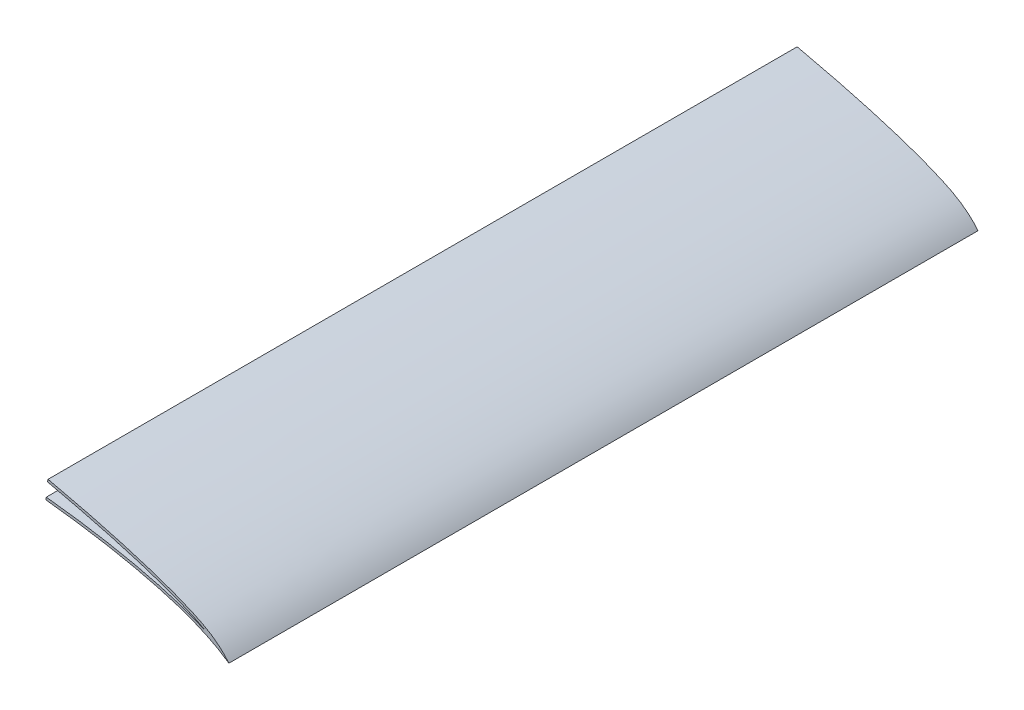
from build123d import *

# Parameters (mm, degrees)
BOSS_EXTRUDE1_DEPTH = 457.2


with BuildPart() as part:
    # Sketch1 → Boss-Extrude1 (new body)
    with BuildSketch(Plane(origin=(0, 0, 319.681194078), x_dir=(-1, 0, 0), z_dir=(0, 0, -1))):
        with BuildLine():
            Line((-584.246414259, 388.168240851), (-584.592980695, 389.717449667))
            add(Edge.make_bspline(
                [(-584.592980695, 389.717449667), (-594.239028931, 387.55957623), (-608.665062265, 384.125823447), (-627.762599785, 379.000812103), (-641.985832617, 374.815696623), (-653.728443855, 370.95513889), (-663.004227299, 367.537908093), (-669.877072897, 364.763096927), (-676.654462619, 361.727818739), (-682.087698438, 358.813957971), (-686.264097225, 356.011835466), (-689.293606327, 353.621302195), (-691.722959726, 351.338504762), (-693.593228522, 349.322103903), (-694.516463088, 348.229332832), (-694.960862649, 347.67808346)],
                knots=[0.031056695, 0.031056695, 0.031056695, 0.031056695, 0.0773531, 0.100501302, 0.123649504, 0.146797707, 0.158371808, 0.169945909, 0.18152001, 0.193094112, 0.198881162, 0.204668213, 0.210455263, 0.213348789, 0.216242314, 0.216242314, 0.216242314, 0.216242314], degree=3))
            add(Edge.make_bspline(
                [(-694.960862649, 347.67808346), (-691.029024668, 350.46721702), (-682.671305419, 355.295271928), (-669.098277725, 360.85912053), (-655.150353557, 365.206363312), (-636.268825679, 370.004149325), (-612.334315948, 374.563254744), (-593.019380349, 377.112386588), (-583.339057813, 378.162916045)],
                knots=[0.778364638, 0.778364638, 0.778364638, 0.778364638, 0.802103787, 0.825842935, 0.849582084, 0.873321232, 0.920799529, 0.968277825, 0.968277825, 0.968277825, 0.968277825], degree=3))
            Line((-583.339057813, 378.162916045), (-583.510331137, 379.741149773))
            add(Edge.make_bspline(
                [(-681.102399799, 357.442024642), (-677.282801125, 359.219513192), (-669.437307682, 362.364981007), (-653.436794258, 367.438773544), (-633.079929041, 372.324399269), (-608.384907828, 376.714386582), (-591.813672406, 378.840053289), (-583.510331137, 379.741149773)],
                knots=[0.805836244, 0.805836244, 0.805836244, 0.805836244, 0.826141442, 0.846446639, 0.887057035, 0.92766743, 0.968277825, 0.968277825, 0.968277825, 0.968277825], degree=3))
            add(Edge.make_bspline(
                [(-584.246414259, 388.168240851), (-592.558644622, 386.308749724), (-609.142719594, 382.390632282), (-629.698668264, 376.857765233), (-645.962941297, 371.875785825), (-658.028901474, 367.768621453), (-667.89796841, 363.914761835), (-675.611115855, 360.442697269), (-679.304249684, 358.507222217), (-681.102399799, 357.442024642)],
                knots=[0.031056695, 0.031056695, 0.031056695, 0.031056695, 0.071019239, 0.110981784, 0.130963056, 0.150944329, 0.170925601, 0.180916237, 0.190906873, 0.190906873, 0.190906873, 0.190906873], degree=3))
        make_face()
    extrude(amount=-BOSS_EXTRUDE1_DEPTH)


solid = part.part
